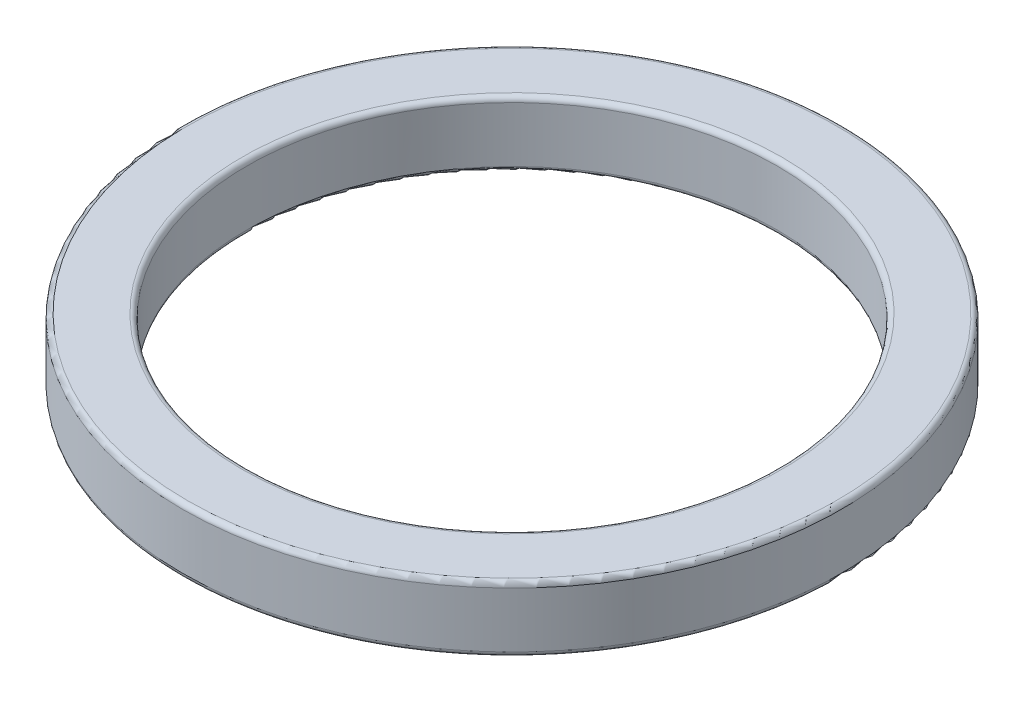
from build123d import *

# Parameters (mm, degrees)
ESQUISSE1_W = 1.28
ESQUISSE1_H = 1.3
CONG_1_R    = 0.1


with BuildPart() as part:
    # Esquisse1 → Révolution1 (revolve)
    with BuildSketch(Plane.XY, mode=Mode.PRIVATE) as r_volution1_sk:
        with Locations((5.91, 2.321727173)):
            Rectangle(ESQUISSE1_W, ESQUISSE1_H)
    revolve(r_volution1_sk.sketch.rotate(Axis((0, 0, 0), (0, 1, 0)), 90), axis=Axis((0, 0, 0), (0, 1, 0)))

    # Congé1
    cong_1_edges = [part.edges().sort_by_distance(p)[0] for p in [
        (0, 2.971727173, 5.27),
        (0, 2.971727173, 6.55),
        (0, 1.671727173, 6.55),
        (0, 1.671727173, 5.27),
    ]]
    fillet(cong_1_edges, radius=CONG_1_R)


solid = part.part
